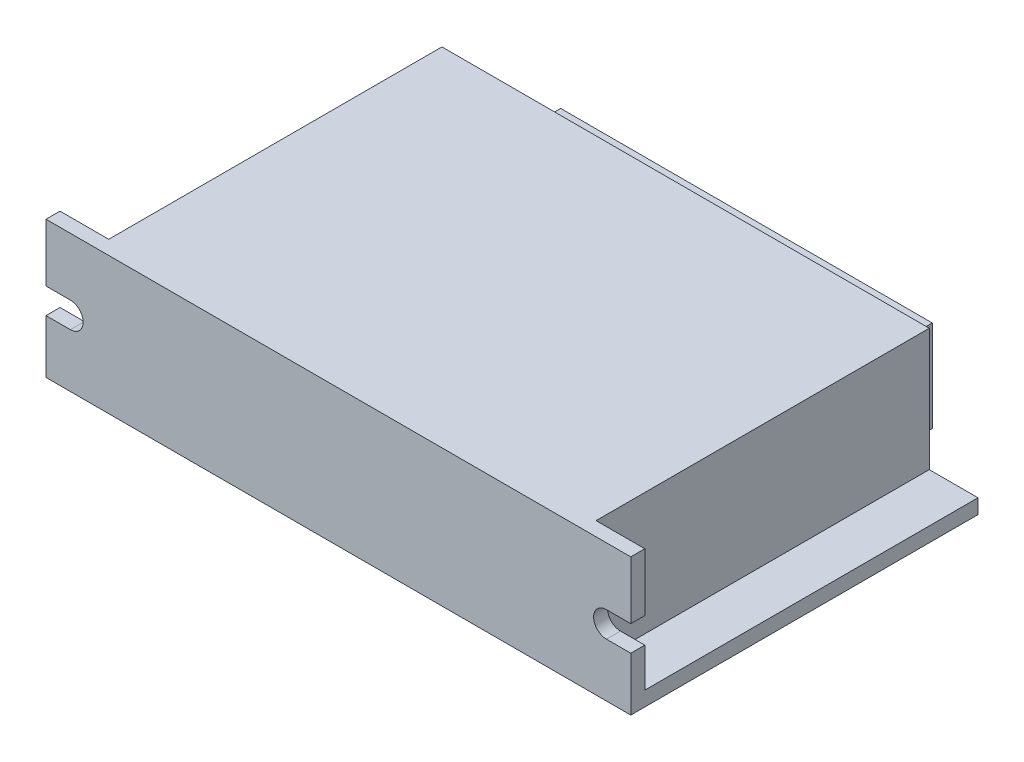
from build123d import *

# Parameters (mm, degrees)
SKETCH_1_W          = 96
SKETCH_1_H          = 57
EXTRUDE_1_DEPTH     = 22.5
SKETCH_2_W          = 61
SKETCH_2_H          = 15
EXTRUDE_2_DEPTH     = 10
SKETCH_3_W          = 8
SKETCH_3_H          = 54.7
CUT_EXTRUDE_1_DEPTH = 20.1
CUT_EXTRUDE_2_DEPTH = 84.64412711


with BuildPart() as part:
    # 草图1 → 凸台-拉伸1 (new body)
    with BuildSketch(Plane(origin=(0, 0, 0), x_dir=(1, 0, 0), z_dir=(0, 1, 0))):
        Rectangle(SKETCH_1_W, SKETCH_1_H)
    extrude(amount=EXTRUDE_1_DEPTH)

    # 草图2 → 凸台-拉伸2 (add)
    with BuildSketch(Plane(origin=(0, 0, -28.5), x_dir=(-1, 0, 0), z_dir=(0, 0, -1))):
        with Locations((0, 6)):
            Rectangle(SKETCH_2_W, SKETCH_2_H)
    extrude(amount=EXTRUDE_2_DEPTH)

    # 草图3 → 切除-拉伸1 (cut)
    with BuildSketch(Plane(origin=(0, 22.5, 0), x_dir=(1, 0, 0), z_dir=(0, 1, 0))):
        with Locations((44, 1.15)):
            Rectangle(SKETCH_3_W, SKETCH_3_H)
    cut_extrude_1 = extrude(amount=-CUT_EXTRUDE_1_DEPTH, mode=Mode.SUBTRACT)

    # 草图4 → 切除-拉伸2 (cut, through all)
    with BuildSketch(Plane(origin=(0, 0, 26.2), x_dir=(-1, 0, 0), z_dir=(0, 0, -1))):
        with BuildLine():
            Line((-44, 8.8), (-48, 8.8))
            Line((-48, 8.8), (-48, 13))
            Line((-48, 13), (-44, 13))
            ThreePointArc((-44, 13), (-41.9, 10.9), (-44, 8.8))
        make_face()
    cut_extrude_2 = extrude(amount=-CUT_EXTRUDE_2_DEPTH, mode=Mode.SUBTRACT)

    # 镜向2: 切除-拉伸1, 切除-拉伸2 across plane
    add(cut_extrude_1.mirror(Plane(origin=(0, 0, 0), x_dir=(0, 0, 1), z_dir=(1, 0, 0))), mode=Mode.SUBTRACT)
    add(cut_extrude_2.mirror(Plane(origin=(0, 0, 0), x_dir=(0, 0, 1), z_dir=(1, 0, 0))), mode=Mode.SUBTRACT)


solid = part.part
